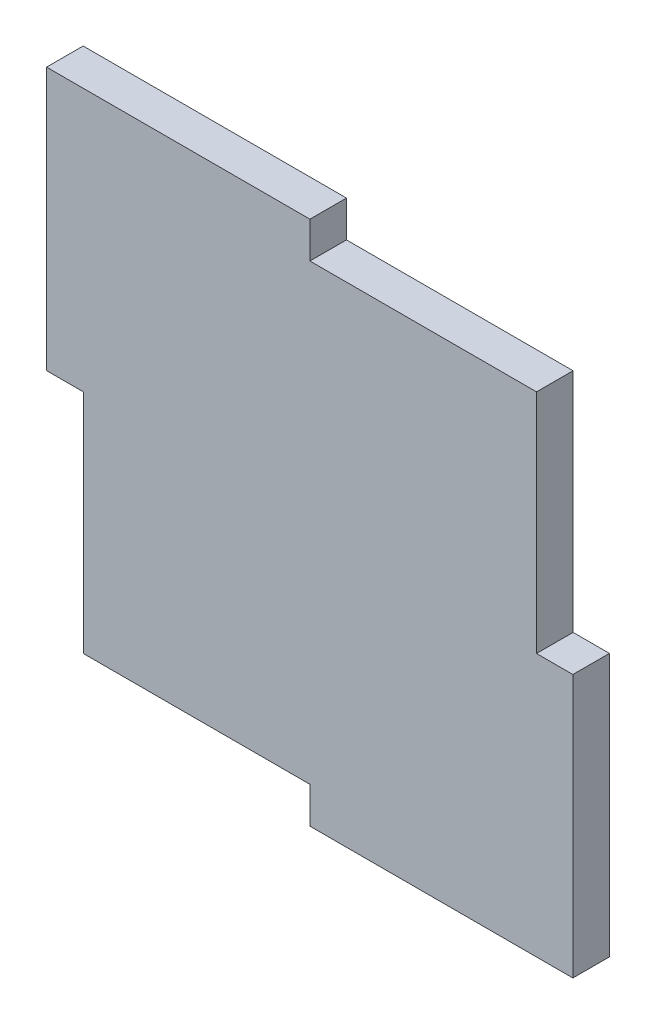
from build123d import *

# Parameters (mm, degrees)
BOSS_EXTRUDE1_DEPTH = 3.0734


with BuildPart() as part:
    # Sketch1 → Boss-Extrude1 (new body)
    with BuildSketch(Plane.XY):
        Polygon((3.089625258, 19.05), (3.089625258, 0), (22.139625258, 0), (22.139625258, -3.048), (44.245341742, -3.048), (44.245341742, 19.05), (41.189625258, 19.05), (41.189625258, 38.1), (22.139625258, 38.1), (22.139625258, 41.148), (0, 41.148), (0, 19.05), align=None)
    extrude(amount=BOSS_EXTRUDE1_DEPTH)


solid = part.part
